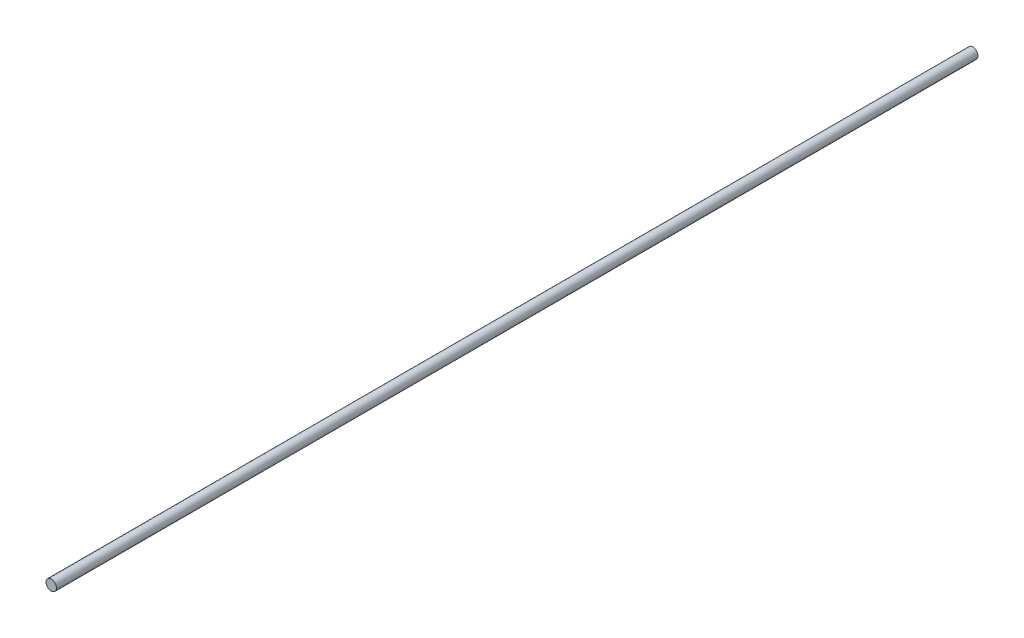
from build123d import *

# Parameters (mm, degrees)
SKETCH2_R           = 6.35
BOSS_EXTRUDE2_DEPTH = 1122.934


with BuildPart() as part:
    # Sketch2 → Boss-Extrude2 (new body)
    with BuildSketch(Plane.XY):
        with Locations((14.807345545, 22.836823138)):
            Circle(SKETCH2_R)
    extrude(amount=BOSS_EXTRUDE2_DEPTH)


solid = part.part
